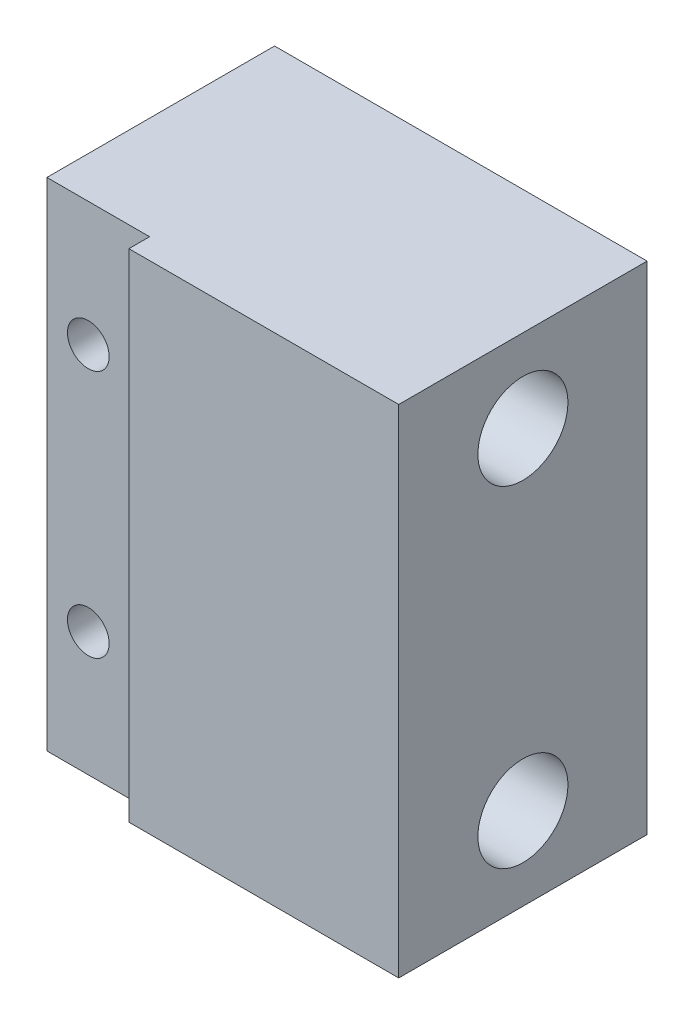
from build123d import *

# Parameters (mm, degrees)
SKETCH1_W                 = 9.525
SKETCH1_H                 = 19.05
BOSS_EXTRUDE1_DEPTH       = 14.2875
F_8_32_TAPPED_HOLE1_D     = 3.4544
F_8_32_TAPPED_HOLE1_DEPTH = 11.43
F_8_32_TAPPED_HOLE1_TIP   = 1.037806461
SKETCH4_W                 = 3.937500126
SKETCH4_H                 = 0.79375
CUT_EXTRUDE1_DEPTH        = 25.284080433
M2X0_4_TAPPED_HOLE1_D     = 1.6


with BuildPart() as part:
    # Sketch1 → Boss-Extrude1 (new body)
    with BuildSketch(Plane(origin=(0, 0, 0), x_dir=(0, 0, -1), z_dir=(1, 0, 0))):
        Rectangle(SKETCH1_W, SKETCH1_H)
    extrude(amount=-BOSS_EXTRUDE1_DEPTH)

    # #8-32 Tapped Hole1
    with Locations(Plane(origin=(0, 0, 0), x_dir=(0, 0, -1), z_dir=(1, 0, 0))):
        with Locations((0, 6.35), (0, -6.35)):
            Hole(F_8_32_TAPPED_HOLE1_D / 2, depth=F_8_32_TAPPED_HOLE1_DEPTH)
            with Locations((0, 0, -(F_8_32_TAPPED_HOLE1_DEPTH + F_8_32_TAPPED_HOLE1_TIP / 2))):  # 118° drill point
                Cone(0, F_8_32_TAPPED_HOLE1_D / 2, F_8_32_TAPPED_HOLE1_TIP, mode=Mode.SUBTRACT)

    # Sketch4 → Cut-Extrude1 (cut, through all)
    with BuildSketch(Plane(origin=(0, 9.525, 0), x_dir=(1, 0, 0), z_dir=(0, 1, 0))):
        with Locations((-12.318749937, -4.365625)):
            Rectangle(SKETCH4_W, SKETCH4_H)
    extrude(amount=-CUT_EXTRUDE1_DEPTH, mode=Mode.SUBTRACT)

    # M2x0.4 Tapped Hole1 (through all)
    with Locations(Plane.XY.offset(3.96875)):
        with Locations((-12.7, -4.764999995), (-12.7, 4.764999995)):
            Hole(M2X0_4_TAPPED_HOLE1_D / 2)


solid = part.part
